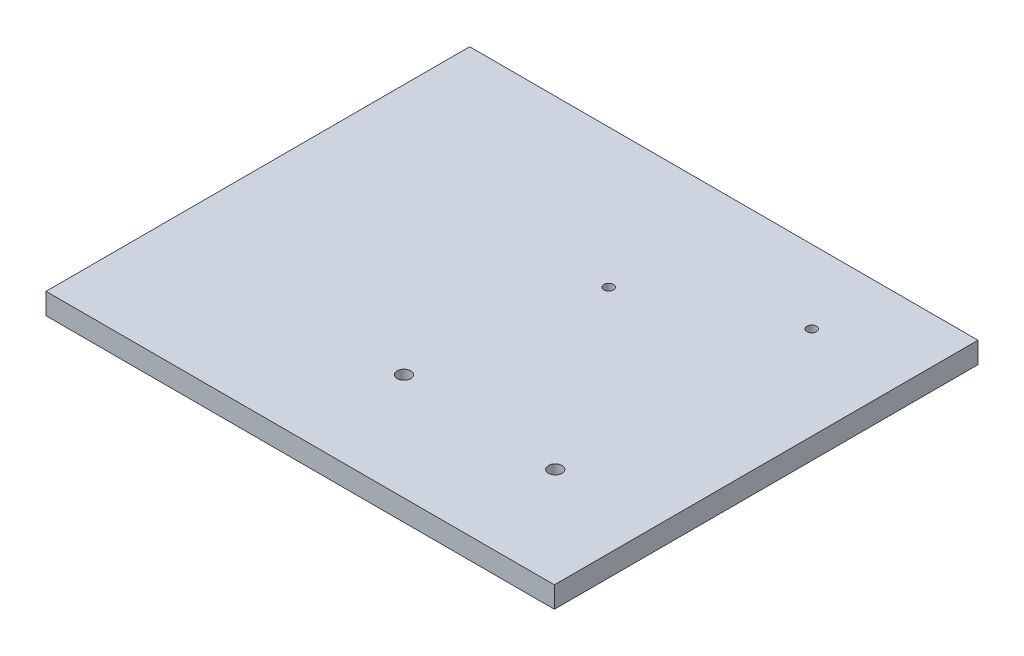
from build123d import *

# Parameters (mm, degrees)
SKETCH1_W           = 120
SKETCH1_H           = 100
SKETCH1_R           = 1.6
SKETCH1_R_2         = 1.13
BOSS_EXTRUDE1_DEPTH = 5


with BuildPart() as part:
    # Sketch1 → Boss-Extrude1 (new body)
    with BuildSketch(Plane(origin=(0, 0, 0), x_dir=(1, 0, 0), z_dir=(0, 1, 0))):
        Rectangle(SKETCH1_W, SKETCH1_H)
        with Locations(Location((36.5, -26.3, 0), (0, 0, 270))):
            Circle(SKETCH1_R, mode=Mode.SUBTRACT)
        with Locations(Location((-0.7, -24.8, 0), (0, 0, 270))):
            Circle(SKETCH1_R, mode=Mode.SUBTRACT)
        with Locations(Location((38.07, 32.68, 0), (0, 0, 270))):
            Circle(SKETCH1_R_2, mode=Mode.SUBTRACT)
        with Locations(Location((5.56, 17.26, 0), (0, 0, 270))):
            Circle(SKETCH1_R_2, mode=Mode.SUBTRACT)
    extrude(amount=BOSS_EXTRUDE1_DEPTH)


solid = part.part
